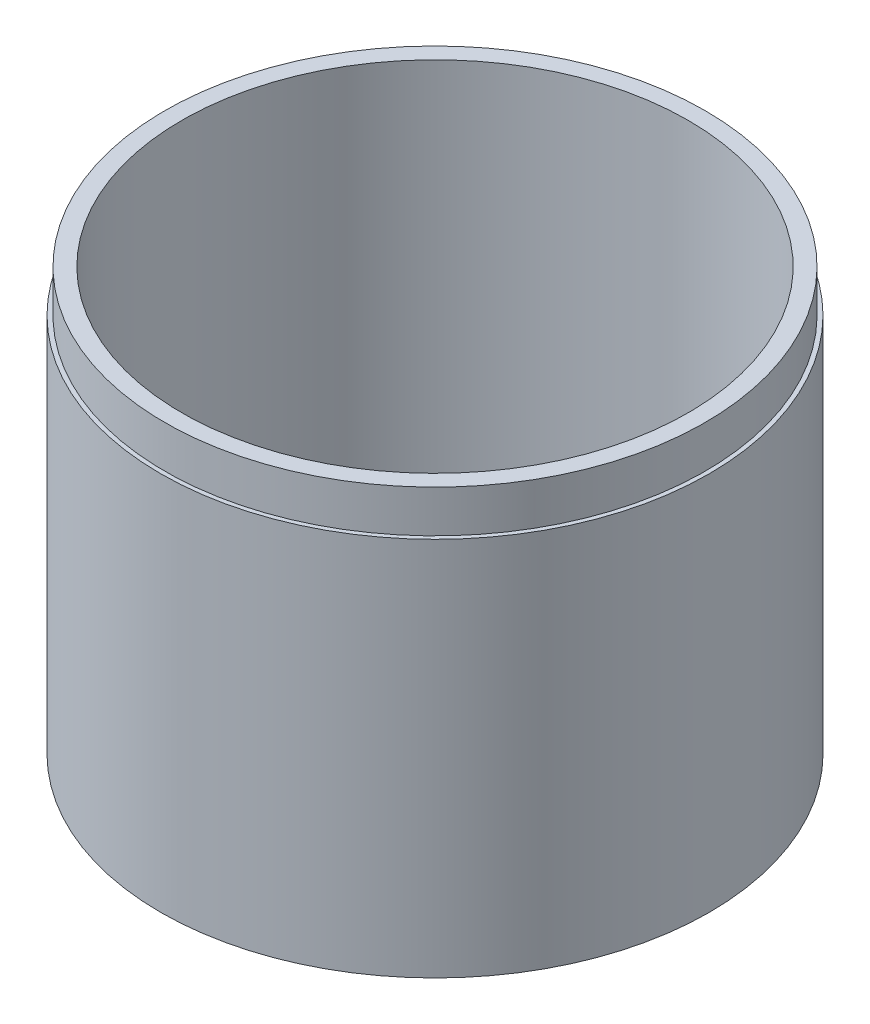
from build123d import *


with BuildPart() as part:
    # Szkic1 → Obrót1 (revolve)
    with BuildSketch(Plane.XY, mode=Mode.PRIVATE) as obr_t1_sk:
        Polygon((-65, 0), (-63, 0), (-63, 10), (-60, 10), (-60, 100), (-64, 100), (-64, 90), (-65, 90), (-65, 10), align=None)
    revolve(obr_t1_sk.sketch.rotate(Axis((0, 0, 0), (0, 1, 0)), 270), axis=Axis((0, 0, 0), (0, 1, 0)))


solid = part.part
